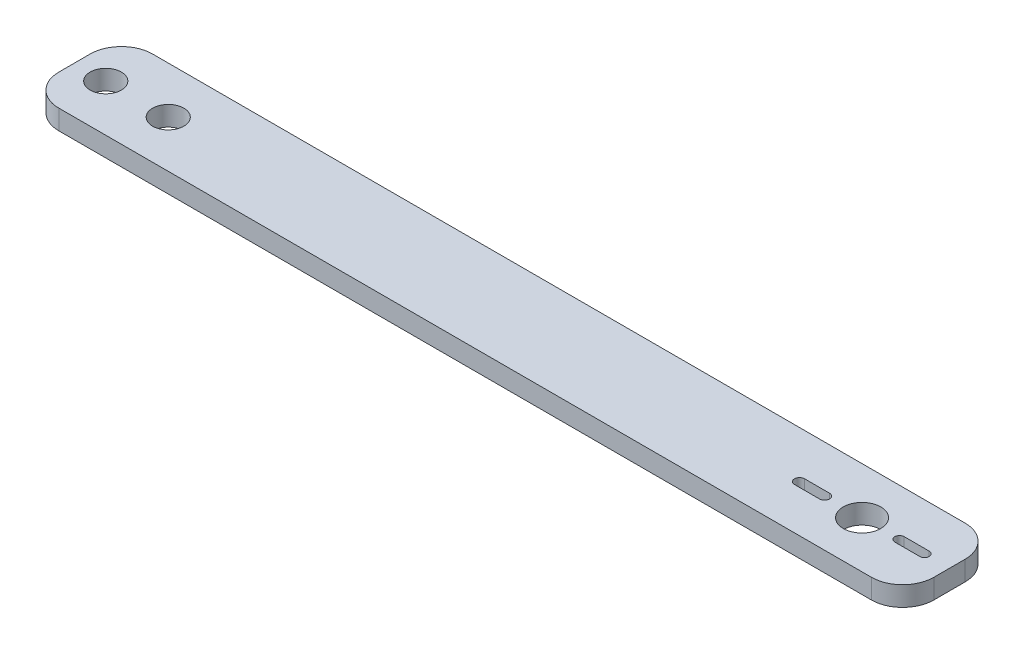
from build123d import *

# Parameters (mm, degrees)
SKETCH1_W           = 177.8
SKETCH1_H           = 19.05
BOSS_EXTRUDE1_DEPTH = 4
FILLET1_R           = 6.35
SKETCH2_R           = 3.175
SKETCH2_R_2         = 3.81
CUT_EXTRUDE1_DEPTH  = 125.624860515


with BuildPart() as part:
    # Sketch1 → Boss-Extrude1 (new body)
    with BuildSketch(Plane(origin=(0, 0, 0), x_dir=(1, 0, 0), z_dir=(0, 1, 0))):
        with Locations((34.502018925, 7.424854969)):
            Rectangle(SKETCH1_W, SKETCH1_H)
    extrude(amount=BOSS_EXTRUDE1_DEPTH)

    # Fillet1
    fillet1_edges = [part.edges().sort_by_distance(p)[0] for p in [
        (-54.397981075, 2, -16.949854969),
        (123.402018925, 2, -16.949854969),
        (123.402018925, 2, 2.100145031),
        (-54.397981075, 2, 2.100145031),
    ]]
    fillet(fillet1_edges, radius=FILLET1_R)

    # Sketch2 → Cut-Extrude1 (cut, through all)
    with BuildSketch(Plane(origin=(0, 4, 0), x_dir=(1, 0, 0), z_dir=(0, 1, 0))):
        with Locations(Location((-48.047981075, 7.424854969, 0), (0, 0, 270))):
            Circle(SKETCH2_R)
        with Locations(Location((-35.347981075, 7.424854969, 0), (0, 0, 270))):
            Circle(SKETCH2_R)
        with Locations(Location((105.622018925, 7.424854969, 0), (0, 0, 270))):
            Circle(SKETCH2_R_2)
        with BuildLine():
            Line((113.242018925, 8.377354969), (118.322018925, 8.377354969))
            ThreePointArc((118.322018925, 8.377354969), (119.274518925, 7.424854969), (118.322018925, 6.472354969))
            Line((118.322018925, 6.472354969), (113.242018925, 6.472354969))
            ThreePointArc((113.242018925, 6.472354969), (112.289518925, 7.424854969), (113.242018925, 8.377354969))
        make_face()
        with BuildLine():
            Line((98.002018925, 6.408854969), (92.922018925, 6.408854969))
            ThreePointArc((92.922018925, 6.408854969), (91.906018925, 7.424854969), (92.922018925, 8.440854969))
            Line((92.922018925, 8.440854969), (98.002018925, 8.440854969))
            ThreePointArc((98.002018925, 8.440854969), (99.018018925, 7.424854969), (98.002018925, 6.408854969))
        make_face()
    extrude(amount=-CUT_EXTRUDE1_DEPTH, mode=Mode.SUBTRACT)


solid = part.part
